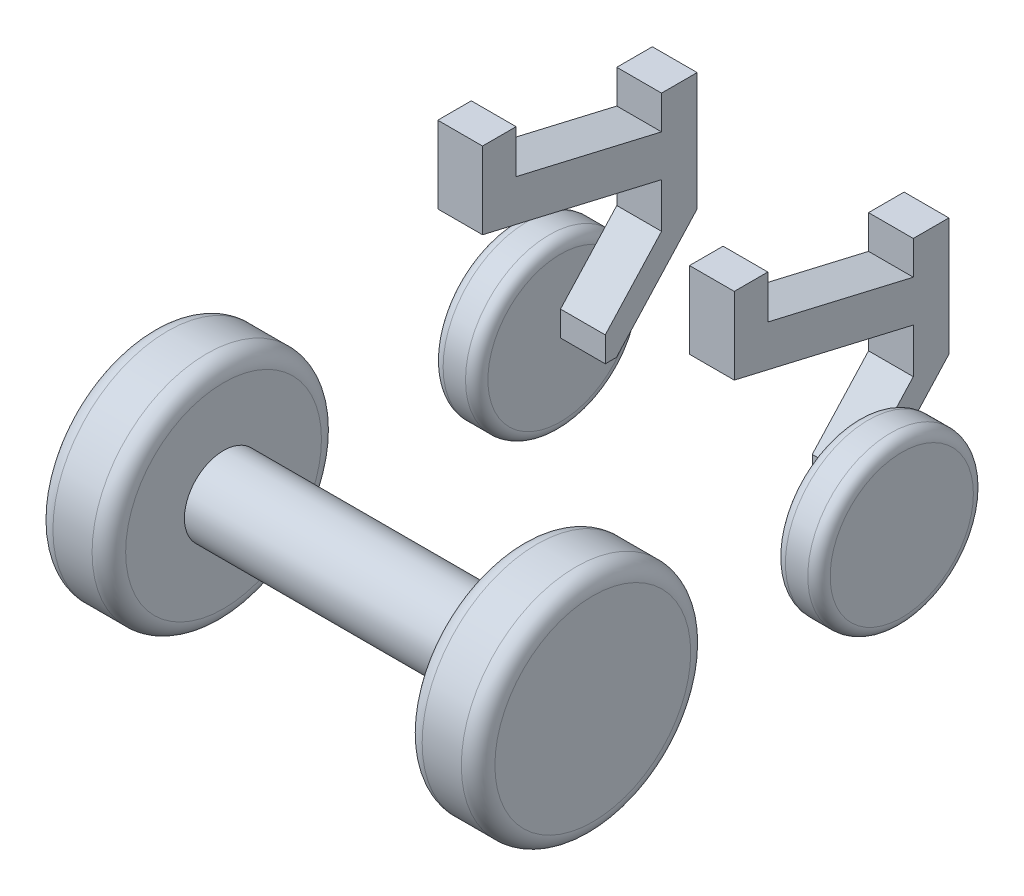
from build123d import *

# Parameters (mm, degrees)
SKETCH2_R           = 130.175
BOSS_EXTRUDE1_DEPTH = 82.55
FILLET1_R           = 19.05
SKETCH3_R           = 44.45
BOSS_EXTRUDE2_DEPTH = 336.55
BOSS_EXTRUDE3_START = 82.55
SKETCH4_R           = 130.175
BOSS_EXTRUDE3_DEPTH = 82.55
FILLET3_R           = 19.05
SKETCH5_R           = 93.98
BOSS_EXTRUDE5_DEPTH = 50.8
FILLET4_R           = 12.7
SKETCH9_R           = 95.147991529
BOSS_EXTRUDE7_DEPTH = 50.8
FILLET5_R           = 12.7
BOSS_EXTRUDE8_DEPTH = 50.8
BOSS_EXTRUDE9_DEPTH = 50.8


with BuildPart() as part:
    # Sketch2 → Boss-Extrude1 (new body)
    with BuildSketch(Plane(origin=(0, 0, 0), x_dir=(0, 0, -1), z_dir=(1, 0, 0))):
        Circle(SKETCH2_R)
    extrude(amount=BOSS_EXTRUDE1_DEPTH)

    # Fillet1
    fillet1_edges = [part.edges().sort_by_distance(p)[0] for p in [
        (0, 0, 130.175),
        (82.55, 0, 130.175),
    ]]
    fillet(fillet1_edges, radius=FILLET1_R)

    # Sketch3 → Boss-Extrude2 (add)
    with BuildSketch(Plane.ZY):
        with Locations(Location((0, 0, 0), (0, 0, 180))):
            Circle(SKETCH3_R)
    extrude(amount=BOSS_EXTRUDE2_DEPTH)

    # Sketch4 → Boss-Extrude3 (add)
    with BuildSketch(Plane.ZY.offset(336.55).offset(BOSS_EXTRUDE3_START)):
        with Locations(Location((0, 0, 0), (0, 0, 180))):
            Circle(SKETCH4_R)
    extrude(amount=-BOSS_EXTRUDE3_DEPTH)

    # Fillet3
    fillet3_edges = [part.edges().sort_by_distance(p)[0] for p in [
        (-336.55, 0, 130.175),
        (-419.1, 0, 130.175),
    ]]
    fillet(fillet3_edges, radius=FILLET3_R)


with BuildPart() as body_2:
    # Sketch5 → Boss-Extrude5 (new body)
    with BuildSketch(Plane(origin=(0, 0, 0), x_dir=(0, 0, -1), z_dir=(1, 0, 0))):
        with Locations((382.466145691, -36.195)):
            Circle(SKETCH5_R)
    extrude(amount=BOSS_EXTRUDE5_DEPTH)

    # Fillet4
    fillet4_edges = [body_2.edges().sort_by_distance(p)[0] for p in [
        (0, -36.195, -288.486145691),
        (50.8, -36.195, -288.486145691),
    ]]
    fillet(fillet4_edges, radius=FILLET4_R)


with BuildPart() as body_3:
    # Sketch9 → Boss-Extrude7 (new body)
    with BuildSketch(Plane(origin=(-336.55, 0, 0), x_dir=(0, 0, -1), z_dir=(1, 0, 0))):
        with Locations((382.466145691, -36.195)):
            Circle(SKETCH9_R)
    extrude(amount=-BOSS_EXTRUDE7_DEPTH)

    # Fillet5
    fillet5_edges = [body_3.edges().sort_by_distance(p)[0] for p in [
        (-336.55, -36.195, -287.318154163),
        (-387.35, -36.195, -287.318154163),
    ]]
    fillet(fillet5_edges, radius=FILLET5_R)


with BuildPart() as body_4:
    # Sketch10 → Boss-Extrude8 (new body)
    with BuildSketch(Plane(origin=(-336.55, 0, 0), x_dir=(0, 0, -1), z_dir=(1, 0, 0))):
        Polygon((382.466145691, -36.195), (382.466145691, -7.747), (446.333339345, 62.103), (446.333339345, 197.993), (486.719339345, 197.993), (486.719339345, 63.934506416), (395.166145691, -36.195), align=None)
    extrude(amount=BOSS_EXTRUDE8_DEPTH)

    # Sketch11 → Boss-Extrude9 (add)
    with BuildSketch(Plane(origin=(-285.75, 0, 0), x_dir=(0, 0, -1), z_dir=(1, 0, 0))):
        Polygon((446.333339345, 112.903), (243.133339345, 160.316333333), (243.133339345, 247.565333333), (281.233339345, 247.565333333), (281.233339345, 198.416333333), (446.333339345, 159.893), align=None)
    extrude(amount=-BOSS_EXTRUDE9_DEPTH)


with BuildPart() as body_5:
    # Mirror15: mirrored copy
    add(body_4.part.mirror(Plane.ZY.offset(168.275)))


solid = Compound([part.part, body_2.part, body_3.part, body_4.part, body_5.part])
